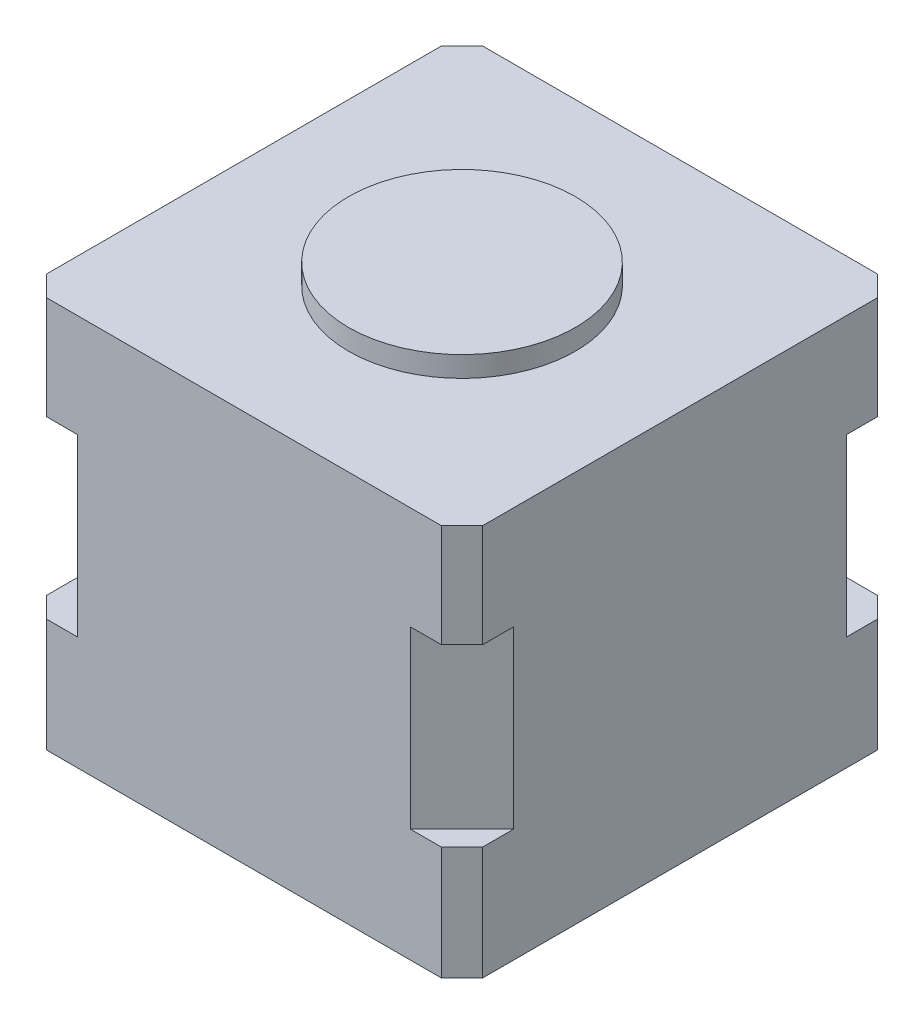
from build123d import *

# Parameters (mm, degrees)
BOSS_EXTRUDE1_DEPTH = 11
BOSS_EXTRUDE2_DEPTH = 17
BOSS_EXTRUDE3_DEPTH = 10
SKETCH4_R           = 11
BOSS_EXTRUDE4_DEPTH = 2
SKETCH8_R           = 1.5
CUT_EXTRUDE2_DEPTH  = 4.5


with BuildPart() as part:
    # Sketch1 → Boss-Extrude1 (new body)
    with BuildSketch(Plane(origin=(0, 0, 0), x_dir=(1, 0, 0), z_dir=(0, 1, 0))):
        Polygon((19.15, -21.15), (21.15, -19.15), (21.15, 19.15), (19.15, 21.15), (-19.15, 21.15), (-21.15, 19.15), (-21.15, -19.15), (-19.15, -21.15), align=None)
    extrude(amount=BOSS_EXTRUDE1_DEPTH)

    # Sketch2 → Boss-Extrude2 (add)
    with BuildSketch(Plane(origin=(0, 11, 0), x_dir=(1, 0, 0), z_dir=(0, 1, 0))):
        Polygon((16.15, -21.15), (21.15, -16.15), (21.15, 16.15), (16.15, 21.15), (-16.15, 21.15), (-21.15, 16.15), (-21.15, -16.15), (-16.15, -21.15), align=None)
    extrude(amount=BOSS_EXTRUDE2_DEPTH)

    # Sketch3 → Boss-Extrude3 (add)
    with BuildSketch(Plane(origin=(0, 28, 0), x_dir=(1, 0, 0), z_dir=(0, 1, 0))):
        Polygon((19.15, -21.15), (21.15, -19.15), (21.15, 19.15), (19.15, 21.15), (-19.15, 21.15), (-21.15, 19.15), (-21.15, -19.15), (-19.15, -21.15), align=None)
    extrude(amount=BOSS_EXTRUDE3_DEPTH)

    # Sketch4 → Boss-Extrude4 (add)
    with BuildSketch(Plane(origin=(0, 38, 0), x_dir=(1, 0, 0), z_dir=(0, 1, 0))):
        with Locations(Location((0, 0, 0), (0, 0, 270))):
            Circle(SKETCH4_R)
    extrude(amount=BOSS_EXTRUDE4_DEPTH)

    # Sketch8 → Cut-Extrude2 (cut)
    with BuildSketch(Plane.XZ):
        with Locations(Location((-15.5, 15.5, 0), (0, 0, 270))):
            Circle(SKETCH8_R)
        with Locations(Location((15.5, 15.5, 0), (0, 0, 270))):
            Circle(SKETCH8_R)
        with Locations(Location((15.5, -15.5, 0), (0, 0, 270))):
            Circle(SKETCH8_R)
        with Locations(Location((-15.5, -15.5, 0), (0, 0, 270))):
            Circle(SKETCH8_R)
    extrude(amount=-CUT_EXTRUDE2_DEPTH, mode=Mode.SUBTRACT)


solid = part.part
